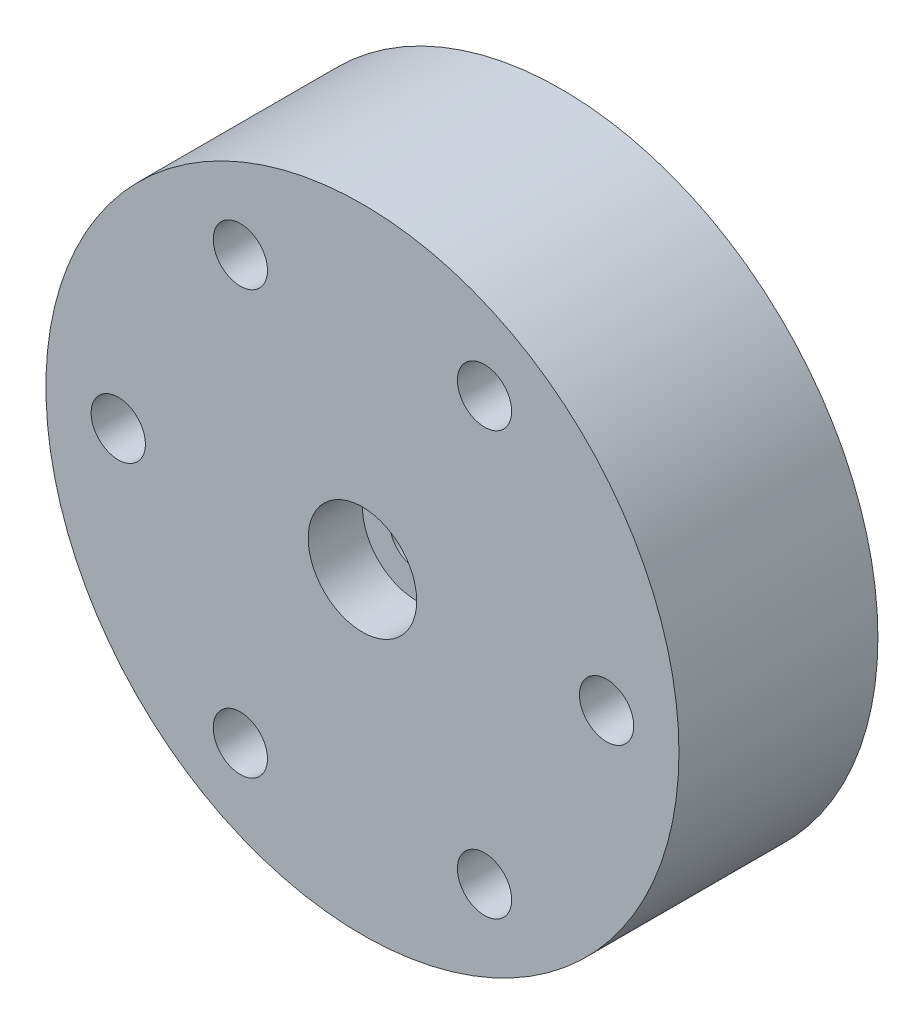
from build123d import *

# Parameters (mm, degrees)
SKETCH_1_R               = 17.5
EXTRUDE_1_DEPTH          = 11
SKETCH_2_R               = 1.5
CUT_EXTRUDE_1_DEPTH      = 5
PATTERN_CIRCULAR_1_COUNT = 6
SKETCH_3_R               = 3
CUT_EXTRUDE_2_DEPTH      = 3
SKETCH_4_R               = 1.5
CUT_EXTRUDE_3_DEPTH      = 5


with BuildPart() as part:
    # 草图1 → 凸台-拉伸1 (new body)
    with BuildSketch(Plane.XY):
        Circle(SKETCH_1_R)
    extrude(amount=EXTRUDE_1_DEPTH)

    # 草图2 → 切除-拉伸1 (cut)
    with BuildSketch(Plane.XY.offset(11)):
        with Locations((13.5, 0)):
            Circle(SKETCH_2_R)
    cut_extrude_1 = extrude(amount=-CUT_EXTRUDE_1_DEPTH, mode=Mode.SUBTRACT)

    # 阵列(圆周)1: 切除-拉伸1 ×6 about axis
    pattern_circular_1_axis = Axis((0, 0, 0), (0, 0, 1))
    for i in range(1, PATTERN_CIRCULAR_1_COUNT):
        add(cut_extrude_1.rotate(pattern_circular_1_axis, i * 360 / PATTERN_CIRCULAR_1_COUNT), mode=Mode.SUBTRACT)

    # 草图3 → 切除-拉伸2 (cut)
    with BuildSketch(Plane.XY.offset(11)):
        Circle(SKETCH_3_R)
    extrude(amount=-CUT_EXTRUDE_2_DEPTH, mode=Mode.SUBTRACT)

    # 草图4 → 切除-拉伸3 (cut)
    with BuildSketch(Plane.XY.offset(8)):
        Circle(SKETCH_4_R)
    extrude(amount=-CUT_EXTRUDE_3_DEPTH, mode=Mode.SUBTRACT)


solid = part.part
